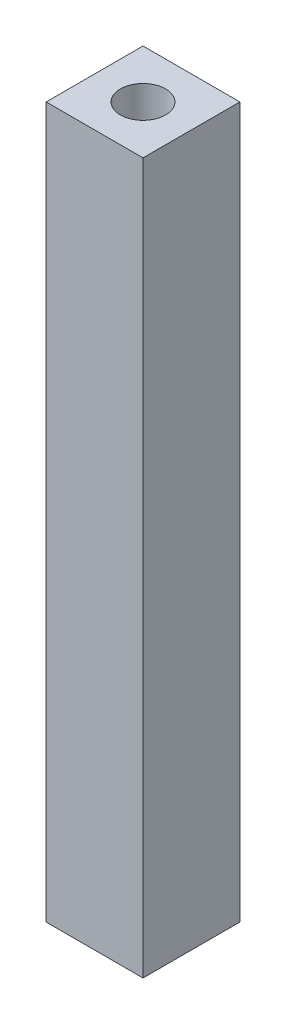
from build123d import *

# Parameters (mm, degrees)
SKETCH_4_W          = 3
SKETCH_4_H          = 3
EXTRUDE_1_DEPTH     = 22
SKETCH_4_5_R        = 0.7
CUT_EXTRUDE_1_DEPTH = 3
CUT_EXTRUDE_START   = 19
SKETCH_4_6_R        = 0.7
CUT_EXTRUDE_2_DEPTH = 3


with BuildPart() as part:
    # 草图4 → 凸台-拉伸1 (new body)
    with BuildSketch(Plane(origin=(0, 0, 0), x_dir=(1, 0, 0), z_dir=(0, 1, 0))):
        Rectangle(SKETCH_4_W, SKETCH_4_H)
    extrude(amount=EXTRUDE_1_DEPTH)

    # 草图4<5> → 切除-拉伸1 (cut)
    with BuildSketch(Plane(origin=(0, 0, 0), x_dir=(1, 0, 0), z_dir=(0, 1, 0))):
        with Locations(Location((0, 0, 0), (0, 0, 270))):
            Circle(SKETCH_4_5_R)
    extrude(amount=CUT_EXTRUDE_1_DEPTH, mode=Mode.SUBTRACT)

    # 草图4<6> → 切除-拉伸2 (cut)
    with BuildSketch(Plane(origin=(0, 0, 0), x_dir=(1, 0, 0), z_dir=(0, 1, 0)).offset(CUT_EXTRUDE_START)):
        with Locations(Location((0, 0, 0), (0, 0, 270))):
            Circle(SKETCH_4_6_R)
    extrude(amount=CUT_EXTRUDE_2_DEPTH, mode=Mode.SUBTRACT)


solid = part.part
